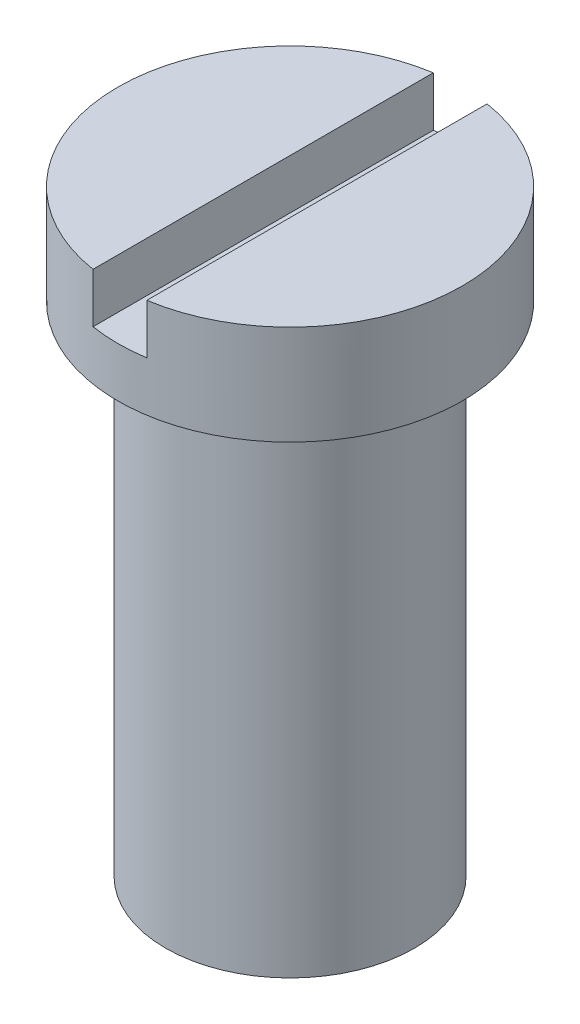
from build123d import *

# Parameters (mm, degrees)
CUT_EXTRUDE1_REACH                  = 14.959
CUT_EXTRUDE1_END_RADIUS             = 3.46
SKETCH2_W                           = 1.08
SKETCH2_H                           = 1
CUT_EXTRUDE1_DIRECTION_2_REACH      = 14.959
CUT_EXTRUDE1_DIRECTION_2_END_RADIUS = 3.46


with BuildPart() as part:
    # Sketch1 → Revolve1 (revolve)
    with BuildSketch(Plane.XY, mode=Mode.PRIVATE) as revolve1_sk:
        Polygon((0, 12), (3.46, 12), (3.46, 10), (2.5, 10), (2.5, 0), (0, 0), align=None)
    revolve(revolve1_sk.sketch.rotate(Axis((0, 0, 0), (0, 1, 0)), 90), axis=Axis((0, 0, 0), (0, 1, 0)))

    # Cut-Extrude1: up to this cylinder (the profile starts inside it)
    cut_extrude1_end = Plane(origin=(0, 11.5, 0), z_dir=(0, -1, 0)) * Cylinder(CUT_EXTRUDE1_END_RADIUS, 37.838, mode=Mode.PRIVATE)
    # Sketch2 → Cut-Extrude1 (cut, up to the surface)
    with BuildSketch(Plane.XY, mode=Mode.PRIVATE) as cut_extrude1_sk1:
        with Locations((0, 11.5)):
            Rectangle(SKETCH2_W, SKETCH2_H)
    cut_extrude1_tool1 = extrude(cut_extrude1_sk1.sketch, amount=-CUT_EXTRUDE1_REACH, mode=Mode.PRIVATE) & cut_extrude1_end
    add(cut_extrude1_tool1.solids().sort_by_distance((0, 11.5, 0))[0], mode=Mode.SUBTRACT)

    # Cut-Extrude1 direction 2: up to this cylinder (the profile starts inside it)
    cut_extrude1_direction_2_end = Plane(origin=(0, 11.5, 0), z_dir=(0, -1, 0)) * Cylinder(CUT_EXTRUDE1_DIRECTION_2_END_RADIUS, 37.838, mode=Mode.PRIVATE)
    # Sketch2 → Cut-Extrude1 direction 2 (cut, up to the surface)
    with BuildSketch(Plane.XY, mode=Mode.PRIVATE) as cut_extrude1_direction_2_sk1:
        with Locations((0, 11.5)):
            Rectangle(SKETCH2_W, SKETCH2_H)
    cut_extrude1_direction_2_tool1 = extrude(cut_extrude1_direction_2_sk1.sketch, amount=CUT_EXTRUDE1_DIRECTION_2_REACH, mode=Mode.PRIVATE) & cut_extrude1_direction_2_end
    add(cut_extrude1_direction_2_tool1.solids().sort_by_distance((0, 11.5, 0))[0], mode=Mode.SUBTRACT)


solid = part.part
